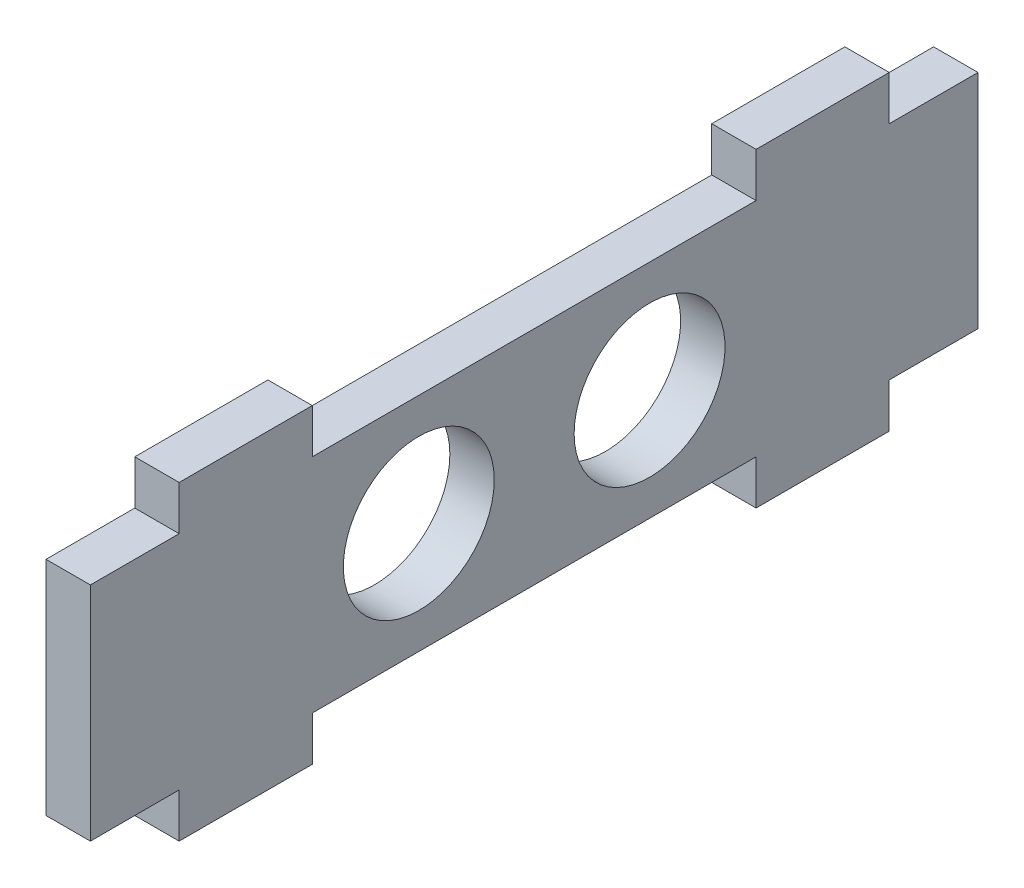
from build123d import *

# Parameters (mm, degrees)
SKETCH2_R           = 8.5
BOSS_EXTRUDE1_DEPTH = 5


with BuildPart() as part:
    # Sketch2 → Boss-Extrude1 (new body)
    with BuildSketch(Plane(origin=(0, 0, 0), x_dir=(0, 0, -1), z_dir=(1, 0, 0))):
        Polygon((-50, -12.5), (-40, -12.5), (-40, -17.5), (-25, -17.5), (-25, -12.5), (25, -12.5), (25, -17.5), (40, -17.5), (40, -12.5), (50, -12.5), (50, 12.5), (40, 12.5), (40, 17.5), (25, 17.5), (25, 12.5), (-25, 12.5), (-25, 17.5), (-40, 17.5), (-40, 12.5), (-50, 12.5), align=None)
        with Locations((-13, 0)):
            Circle(SKETCH2_R, mode=Mode.SUBTRACT)
        with Locations(Location((13, 0, 0), (0, 0, 180))):
            Circle(SKETCH2_R, mode=Mode.SUBTRACT)
    extrude(amount=BOSS_EXTRUDE1_DEPTH)


solid = part.part
